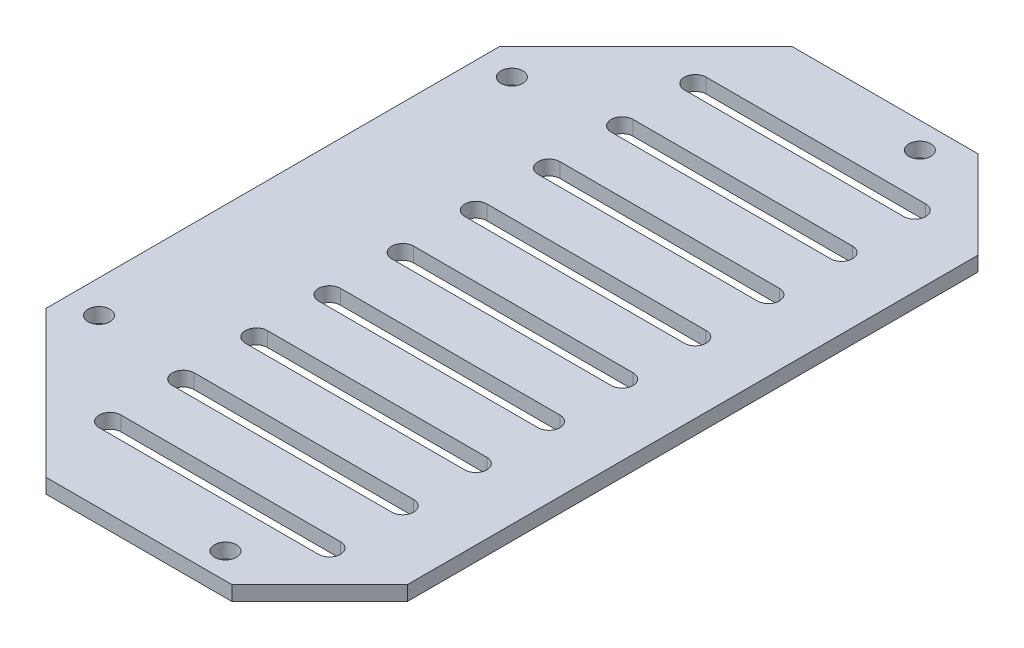
from build123d import *

# Parameters (mm, degrees)
BOSS_EXTRUDE1_DEPTH = 2
CHAMFER1_SIZE       = 12
SKETCH2_R           = 1.5
CUT_EXTRUDE1_DEPTH  = 10


with BuildPart() as part:
    # Sketch1 → Boss-Extrude1 (new body)
    with BuildSketch(Plane(origin=(0, 0, 0), x_dir=(1, 0, 0), z_dir=(0, 1, 0))):
        Polygon((-25.833763343, 95.703211573), (11.576236657, 95.703211573), (11.576236657, -6.301788427), (-25.833763343, -6.301788427), (-45.833763343, 13.698211573), (-45.833763343, 75.703211573), align=None)
        with BuildLine():
            Line((1.925471464, 43.200711573), (-28.074528536, 43.200711573))
            ThreePointArc((-28.074528536, 43.200711573), (-29.574528536, 44.700711573), (-28.074528536, 46.200711573))
            Line((-28.074528536, 46.200711573), (1.925471464, 46.200711573))
            ThreePointArc((1.925471464, 46.200711573), (3.425471464, 44.700711573), (1.925471464, 43.200711573))
        make_face(mode=Mode.SUBTRACT)
        with BuildLine():
            Line((1.925471464, 53.200711573), (-28.074528536, 53.200711573))
            ThreePointArc((-28.074528536, 53.200711573), (-29.574528536, 54.700711573), (-28.074528536, 56.200711573))
            Line((-28.074528536, 56.200711573), (1.925471464, 56.200711573))
            ThreePointArc((1.925471464, 56.200711573), (3.425471464, 54.700711573), (1.925471464, 53.200711573))
        make_face(mode=Mode.SUBTRACT)
        with BuildLine():
            Line((1.925471464, 63.200711573), (-28.074528536, 63.200711573))
            ThreePointArc((-28.074528536, 63.200711573), (-29.574528536, 64.700711573), (-28.074528536, 66.200711573))
            Line((-28.074528536, 66.200711573), (1.925471464, 66.200711573))
            ThreePointArc((1.925471464, 66.200711573), (3.425471464, 64.700711573), (1.925471464, 63.200711573))
        make_face(mode=Mode.SUBTRACT)
        with BuildLine():
            Line((1.925471464, 73.200711573), (-28.074528536, 73.200711573))
            ThreePointArc((-28.074528536, 73.200711573), (-29.574528536, 74.700711573), (-28.074528536, 76.200711573))
            Line((-28.074528536, 76.200711573), (1.925471464, 76.200711573))
            ThreePointArc((1.925471464, 76.200711573), (3.425471464, 74.700711573), (1.925471464, 73.200711573))
        make_face(mode=Mode.SUBTRACT)
        with BuildLine():
            Line((1.925471464, 83.200711573), (-28.074528536, 83.200711573))
            ThreePointArc((-28.074528536, 83.200711573), (-29.574528536, 84.700711573), (-28.074528536, 86.200711573))
            Line((-28.074528536, 86.200711573), (1.925471464, 86.200711573))
            ThreePointArc((1.925471464, 86.200711573), (3.425471464, 84.700711573), (1.925471464, 83.200711573))
        make_face(mode=Mode.SUBTRACT)
        with BuildLine():
            Line((1.925471464, 36.200711573), (-28.074528536, 36.200711573))
            ThreePointArc((-28.074528536, 36.200711573), (-29.574528536, 34.700711573), (-28.074528536, 33.200711573))
            Line((-28.074528536, 33.200711573), (1.925471464, 33.200711573))
            ThreePointArc((1.925471464, 33.200711573), (3.425471464, 34.700711573), (1.925471464, 36.200711573))
        make_face(mode=Mode.SUBTRACT)
        with BuildLine():
            Line((1.925471464, 26.200711573), (-28.074528536, 26.200711573))
            ThreePointArc((-28.074528536, 26.200711573), (-29.574528536, 24.700711573), (-28.074528536, 23.200711573))
            Line((-28.074528536, 23.200711573), (1.925471464, 23.200711573))
            ThreePointArc((1.925471464, 23.200711573), (3.425471464, 24.700711573), (1.925471464, 26.200711573))
        make_face(mode=Mode.SUBTRACT)
        with BuildLine():
            Line((1.925471464, 16.200711573), (-28.074528536, 16.200711573))
            ThreePointArc((-28.074528536, 16.200711573), (-29.574528536, 14.700711573), (-28.074528536, 13.200711573))
            Line((-28.074528536, 13.200711573), (1.925471464, 13.200711573))
            ThreePointArc((1.925471464, 13.200711573), (3.425471464, 14.700711573), (1.925471464, 16.200711573))
        make_face(mode=Mode.SUBTRACT)
        with BuildLine():
            Line((1.925471464, 6.200711573), (-28.074528536, 6.200711573))
            ThreePointArc((-28.074528536, 6.200711573), (-29.574528536, 4.700711573), (-28.074528536, 3.200711573))
            Line((-28.074528536, 3.200711573), (1.925471464, 3.200711573))
            ThreePointArc((1.925471464, 3.200711573), (3.425471464, 4.700711573), (1.925471464, 6.200711573))
        make_face(mode=Mode.SUBTRACT)
    extrude(amount=BOSS_EXTRUDE1_DEPTH)

    # Chamfer1
    chamfer1_edges = [part.edges().sort_by_distance(p)[0] for p in [
        (11.576236657, 1, -95.703211573),
        (11.576236657, 1, 6.301788427),
    ]]
    chamfer(chamfer1_edges, length=CHAMFER1_SIZE)

    # Sketch2 → Cut-Extrude1 (cut)
    with BuildSketch(Plane(origin=(0, 2, 0), x_dir=(1, 0, 0), z_dir=(0, 1, 0))):
        with Locations(Location((-4.838827122, 92.166588575, 0), (0, 0, 270))):
            Circle(SKETCH2_R)
        with Locations(Location((-41.371381926, 72.921675145, 0), (0, 0, 270))):
            Circle(SKETCH2_R)
        with Locations(Location((-41.371381926, 16.479748001, 0), (0, 0, 270))):
            Circle(SKETCH2_R)
        with Locations(Location((-4.838827122, -2.765165428, 0), (0, 0, 270))):
            Circle(SKETCH2_R)
    extrude(amount=-CUT_EXTRUDE1_DEPTH, mode=Mode.SUBTRACT)


solid = part.part
